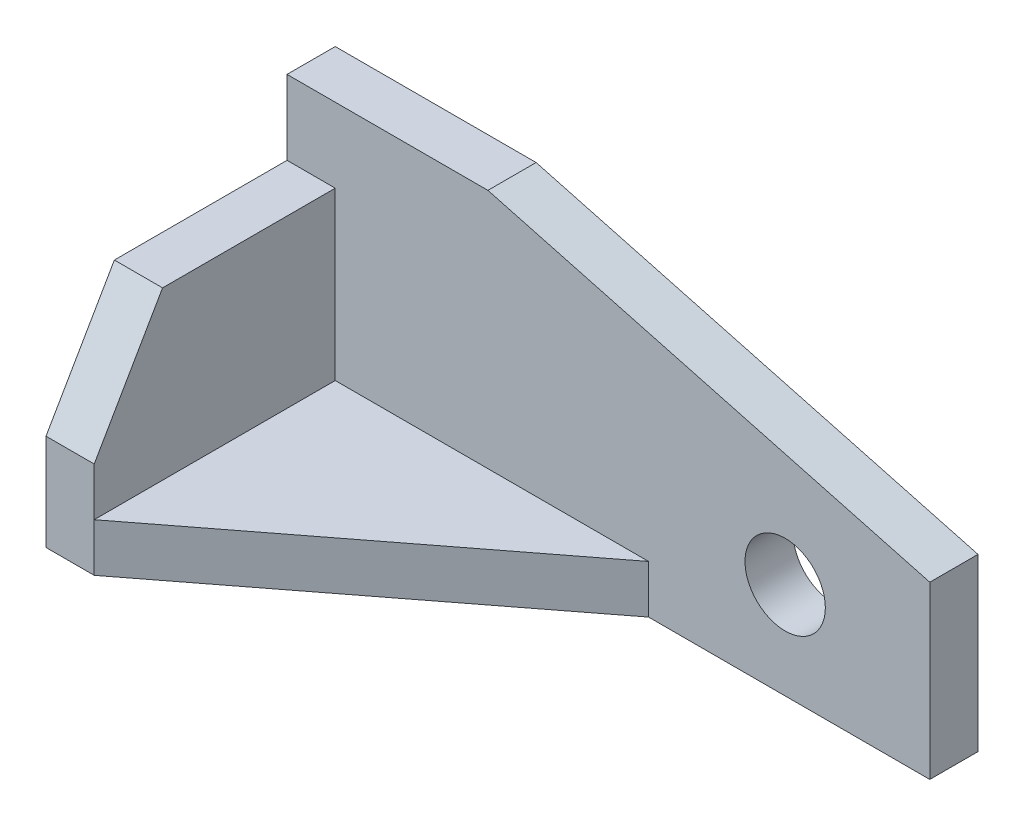
from build123d import *

# Parameters (mm, degrees)
SKETCH_1_R      = 5
EXTRUDE_1_DEPTH = 6
EXTRUDE_2_DEPTH = 6
EXTRUDE_3_DEPTH = 6


with BuildPart() as part:
    # 草圖1 → 填料-伸長1 (new body)
    with BuildSketch(Plane.XY):
        Polygon((0, 0), (80, 0), (80, 21.262794416), (25, 36), (0, 36), align=None)
        with Locations((62, 12)):
            Circle(SKETCH_1_R, mode=Mode.SUBTRACT)
    extrude(amount=-EXTRUDE_1_DEPTH)

    # 草圖2 → 填料-伸長2 (add)
    with BuildSketch(Plane(origin=(0, 0, 0), x_dir=(0, 0, -1), z_dir=(1, 0, 0))):
        Polygon((0, 0), (-30, 0), (-30, 12), (-21.492830392, 26.73484999), (0, 26.73484999), align=None)
    extrude(amount=EXTRUDE_2_DEPTH)

    # 草圖3 → 填料-伸長3 (add)
    with BuildSketch(Plane(origin=(0, 0, 0), x_dir=(1, 0, 0), z_dir=(0, 1, 0))):
        Polygon((0, 0), (45, 0), (6, -30), (0, -30), align=None)
    extrude(amount=EXTRUDE_3_DEPTH)


solid = part.part
